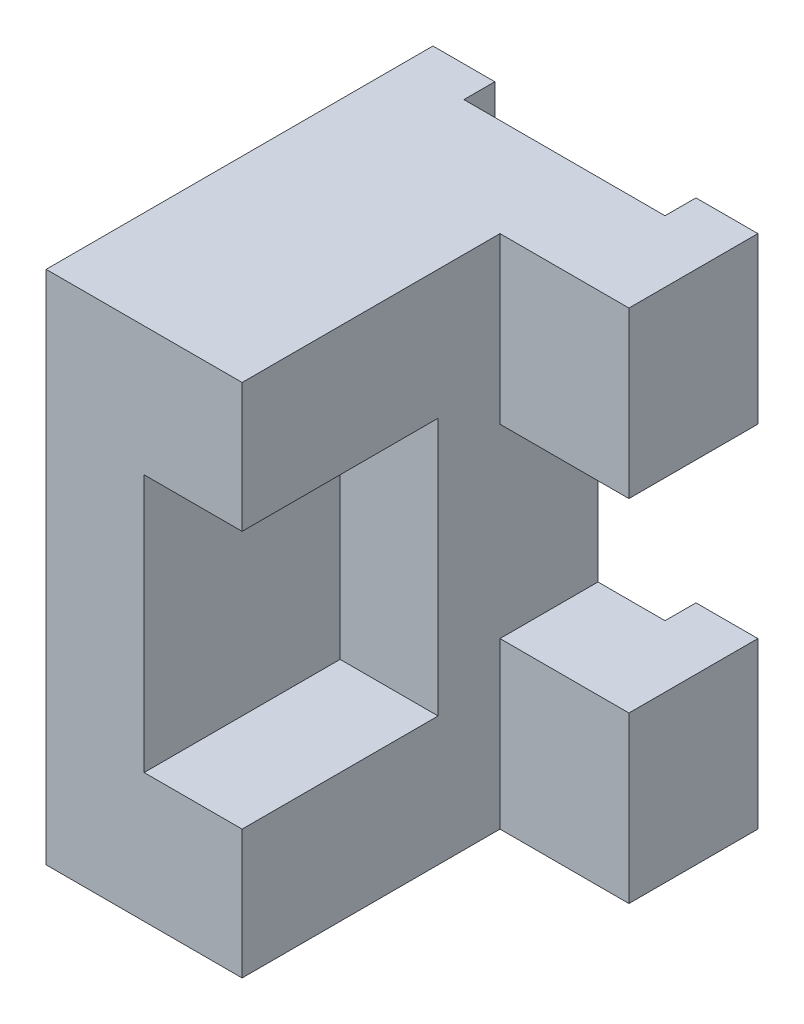
from build123d import *

# Parameters (mm, degrees)
BOSS_EXTRUDE1_DEPTH = 50
SKETCH2_W           = 19
SKETCH2_H           = 50
CUT_EXTRUDE1_DEPTH  = 38
SKETCH3_W           = 25
SKETCH3_H           = 36
CUT_EXTRUDE2_DEPTH  = 38


with BuildPart() as part:
    # Sketch1 → Boss-Extrude1 (new, symmetric)
    with BuildSketch(Plane(origin=(0, 0, 0), x_dir=(-1, 0, 0), z_dir=(0, 1, 0))):
        Polygon((0, 0), (12, 0), (12, 6), (51, 6), (51, 0), (63, 0), (63, 75), (25, 75), (25, 25), (0, 25), align=None)
    extrude(amount=BOSS_EXTRUDE1_DEPTH, both=True)

    # Sketch2 → Cut-Extrude1 (cut)
    with BuildSketch(Plane.XY.offset(75)):
        with Locations((-34.5, 0)):
            Rectangle(SKETCH2_W, SKETCH2_H)
    extrude(amount=-CUT_EXTRUDE1_DEPTH, mode=Mode.SUBTRACT)

    # Sketch3 → Cut-Extrude2 (cut)
    with BuildSketch(Plane.XY.offset(25)):
        with Locations((-12.5, 0)):
            Rectangle(SKETCH3_W, SKETCH3_H)
    extrude(amount=-CUT_EXTRUDE2_DEPTH, mode=Mode.SUBTRACT)


solid = part.part
